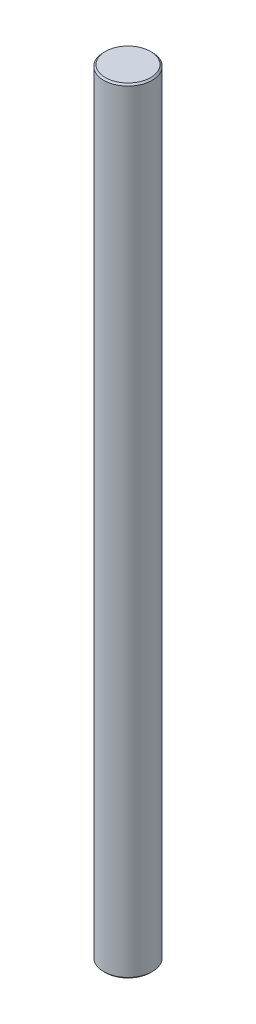
from build123d import *

# Parameters (mm, degrees)
SKETCH1_R           = 3.96875
BOSS_EXTRUDE1_DEPTH = 63.5
CHAMFER1_SIZE       = 0.254


with BuildPart() as part:
    # Sketch1 → Boss-Extrude1 (new, symmetric)
    with BuildSketch(Plane(origin=(0, 0, 0), x_dir=(1, 0, 0), z_dir=(0, 1, 0))):
        with Locations(Location((0, 0, 0), (0, 0, 270))):
            Circle(SKETCH1_R)
    extrude(amount=BOSS_EXTRUDE1_DEPTH, both=True)

    # Chamfer1
    chamfer1_edges = [part.edges().sort_by_distance(p)[0] for p in [
        (0, -63.5, -3.96875),
        (0, 63.5, -3.96875),
    ]]
    chamfer(chamfer1_edges, length=CHAMFER1_SIZE)


solid = part.part
